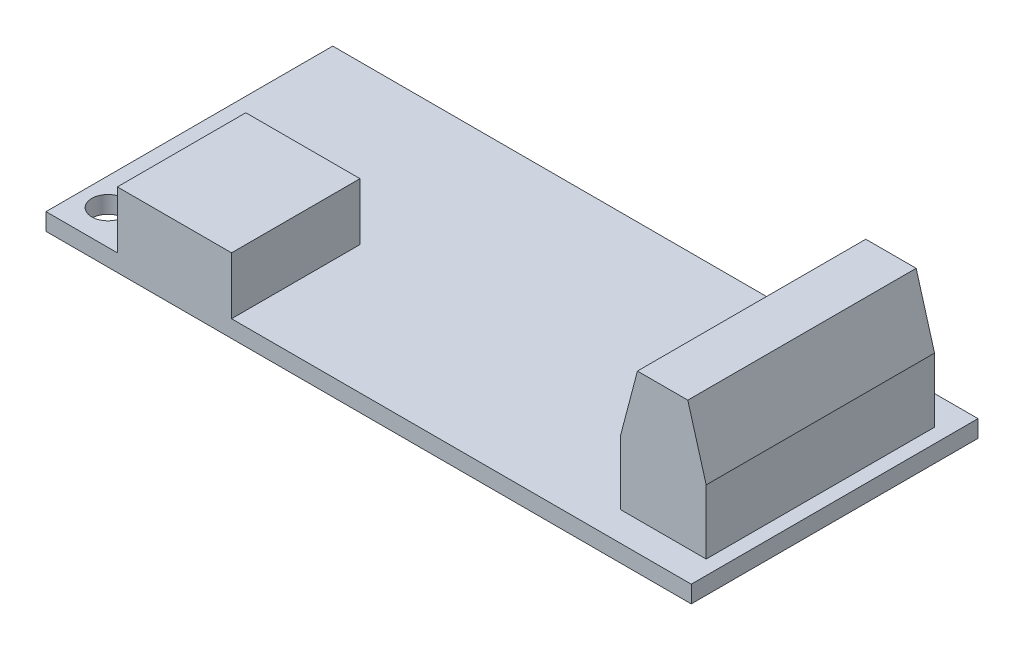
from build123d import *

# Parameters (mm, degrees)
SKETCH1_W           = 45.21
SKETCH1_H           = 20.09
SKETCH1_R           = 1.13
BOSS_EXTRUDE1_DEPTH = 1.2
SKETCH2_W           = 6
SKETCH2_H           = 16
BOSS_EXTRUDE3_DEPTH = 9
CUT_EXTRUDE1_REACH  = 32.67
SKETCH5_W           = 8
SKETCH5_H           = 9
BOSS_EXTRUDE5_DEPTH = 4


with BuildPart() as part:
    # Sketch1 → Boss-Extrude1 (new body)
    with BuildSketch(Plane(origin=(0, 0, 0), x_dir=(1, 0, 0), z_dir=(0, 1, 0))):
        Rectangle(SKETCH1_W, SKETCH1_H)
        with Locations(Location((11.835, 7.785, 0), (0, 0, 270))):
            Circle(SKETCH1_R, mode=Mode.SUBTRACT)
        with Locations(Location((-20.675, -7.635, 0), (0, 0, 270))):
            Circle(SKETCH1_R, mode=Mode.SUBTRACT)
    extrude(amount=BOSS_EXTRUDE1_DEPTH)

    # Sketch2 → Boss-Extrude3 (add)
    with BuildSketch(Plane(origin=(0, 1.2, 0), x_dir=(1, 0, 0), z_dir=(0, 1, 0))):
        with Locations((18.605, 0)):
            Rectangle(SKETCH2_W, SKETCH2_H)
    extrude(amount=BOSS_EXTRUDE3_DEPTH)

    # Sketch4 → Cut-Extrude1 (cut, up to next)
    with BuildSketch(Plane.XY.offset(8), mode=Mode.PRIVATE) as cut_extrude1_sk1:
        Polygon((15.605, 5.7), (16.788227765, 10.2), (15.605, 10.2), align=None)
    cut_extrude1_tool1 = extrude(cut_extrude1_sk1.sketch, amount=-CUT_EXTRUDE1_REACH, mode=Mode.PRIVATE) & part.part
    # Sketch4 → Cut-Extrude1 (cut, up to next)
    with BuildSketch(Plane.XY.offset(8), mode=Mode.PRIVATE) as cut_extrude1_sk2:
        Polygon((20.317369028, 10.2), (21.605, 5.7), (21.605, 10.2), align=None)
    cut_extrude1_tool2 = extrude(cut_extrude1_sk2.sketch, amount=-CUT_EXTRUDE1_REACH, mode=Mode.PRIVATE) & part.part
    add(cut_extrude1_tool1.solids().sort_by_distance((15.999409, 8.7, 8))[0], mode=Mode.SUBTRACT)
    add(cut_extrude1_tool2.solids().sort_by_distance((21.17579, 8.7, 8))[0], mode=Mode.SUBTRACT)

    # Sketch5 → Boss-Extrude5 (add)
    with BuildSketch(Plane(origin=(0, 1.2, 0), x_dir=(1, 0, 0), z_dir=(0, 1, 0))):
        with Locations((-13.605, -5.545)):
            Rectangle(SKETCH5_W, SKETCH5_H)
    extrude(amount=BOSS_EXTRUDE5_DEPTH)


solid = part.part
